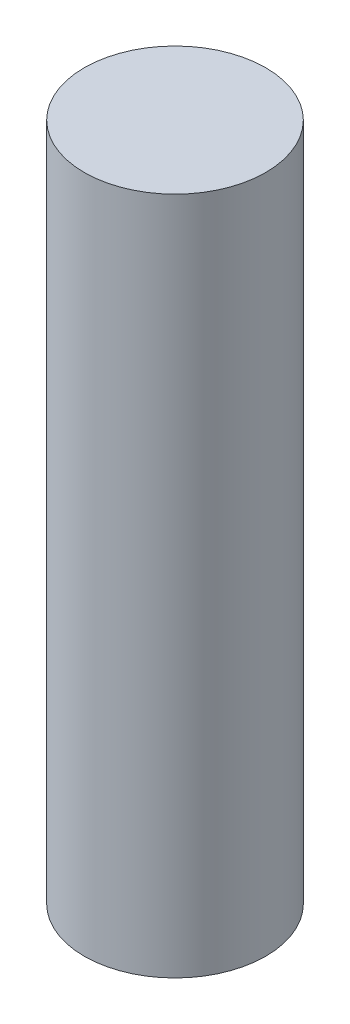
from build123d import *

# Parameters (mm, degrees)
SKETCH2_R           = 1
BOSS_EXTRUDE1_DEPTH = 7.48


with BuildPart() as part:
    # Sketch2 → Boss-Extrude1 (new body)
    with BuildSketch(Plane(origin=(0, 0, 0), x_dir=(1, 0, 0), z_dir=(0, 1, 0))):
        with Locations(Location((0, 0, 0), (0, 0, 270))):
            Circle(SKETCH2_R)
    extrude(amount=BOSS_EXTRUDE1_DEPTH)


solid = part.part
